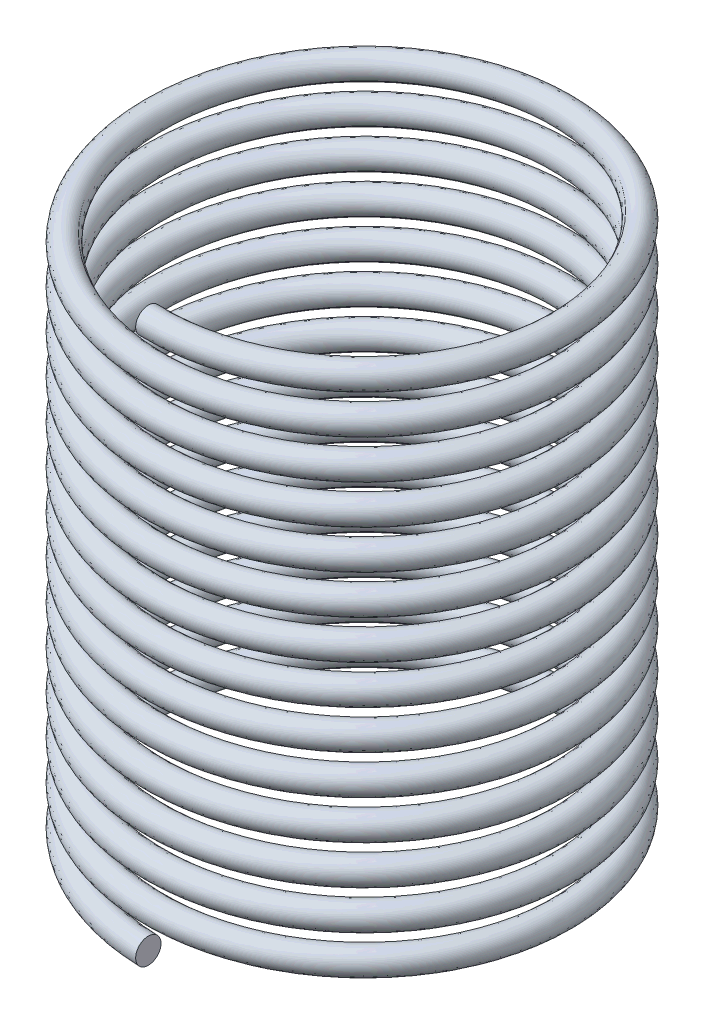
from build123d import *

# Parameters (mm, degrees)
SWEEP1_PITCH  = 2
SWEEP1_HEIGHT = 28
SWEEP1_RADIUS = 10.4375
SKETCH2_R     = 0.65


with BuildPart() as part:
    # Sweep1: sweep along a helix
    with BuildLine() as sweep1_path:
        Helix(SWEEP1_PITCH, SWEEP1_HEIGHT, SWEEP1_RADIUS, center=(0, 0, 0), direction=(0, 1, 0), lefthand=True)
    # Sketch2 → Sweep1 (sweep)
    with BuildSketch(Plane(origin=(0, 0, 0), x_dir=(0, 0, -1), z_dir=(1, 0, 0))):
        with Locations((-10.4375, 0)):
            Circle(SKETCH2_R)
    sweep(path=sweep1_path.line, is_frenet=True)


solid = part.part
